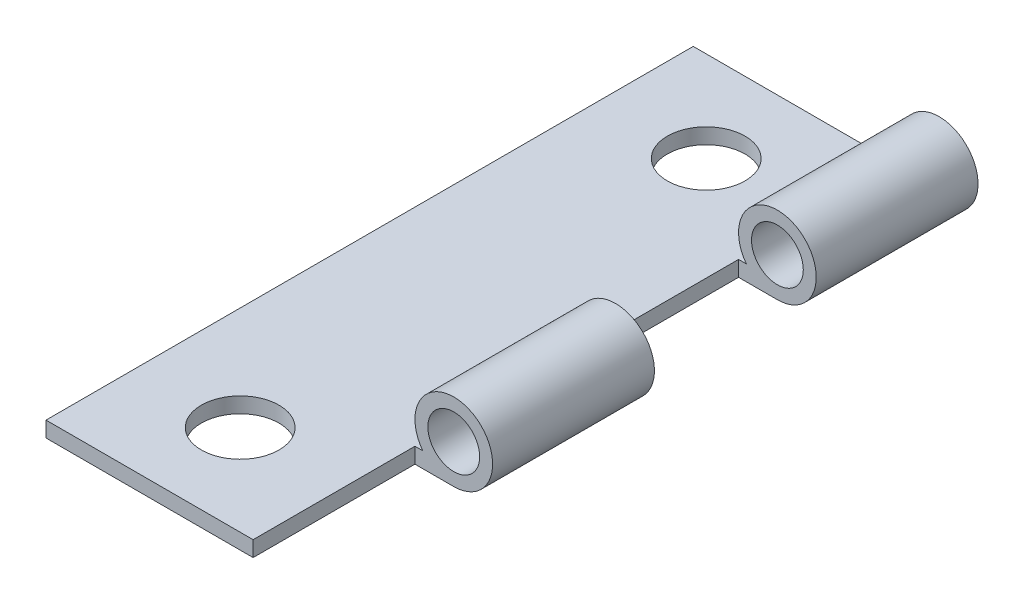
from build123d import *

# Parameters (mm, degrees)
SKETCH_2_R          = 1
EXTRUDE_1_DEPTH     = 12.5
SKETCH_3_W          = 4.099885726
SKETCH_3_H          = 6.25
SKETCH_3_W_2        = 4.685981201
CUT_EXTRUDE_1_DEPTH = 10
SKETCH_4_R          = 1.5
CUT_EXTRUDE_2_DEPTH = 10


with BuildPart() as part:
    # 草图2 → 凸台-拉伸1 (new, symmetric)
    with BuildSketch(Plane.XY):
        with BuildLine():
            Line((0, -1.5), (-9.5, -1.5))
            Line((-9.5, -1.5), (-9.5, -0.9))
            Line((-9.5, -0.9), (-1.2, -0.9))
            ThreePointArc((-1.2, -0.9), (0.670820393, 1.341640786), (0, -1.5))
        make_face()
        Circle(SKETCH_2_R, mode=Mode.SUBTRACT)
    extrude(amount=EXTRUDE_1_DEPTH, both=True)

    # 草图3 → 切除-拉伸1 (cut, symmetric)
    with BuildSketch(Plane(origin=(0, -0.9, 0), x_dir=(1, 0, 0), z_dir=(0, 1, 0))):
        with Locations((0.549942863, 3.125)):
            Rectangle(SKETCH_3_W, SKETCH_3_H)
        with Locations((0.842990601, -9.375)):
            Rectangle(SKETCH_3_W_2, SKETCH_3_H)
    extrude(amount=CUT_EXTRUDE_1_DEPTH, both=True, mode=Mode.SUBTRACT)

    # 草图4 → 切除-拉伸2 (cut)
    with BuildSketch(Plane(origin=(0, -0.9, 0), x_dir=(1, 0, 0), z_dir=(0, 1, 0))):
        with Locations(Location((-5.5, 9, 0), (0, 0, 180))):
            Circle(SKETCH_4_R)
        with Locations(Location((-5.5, -9, 0), (0, 0, 180))):
            Circle(SKETCH_4_R)
    extrude(amount=-CUT_EXTRUDE_2_DEPTH, mode=Mode.SUBTRACT)


solid = part.part
